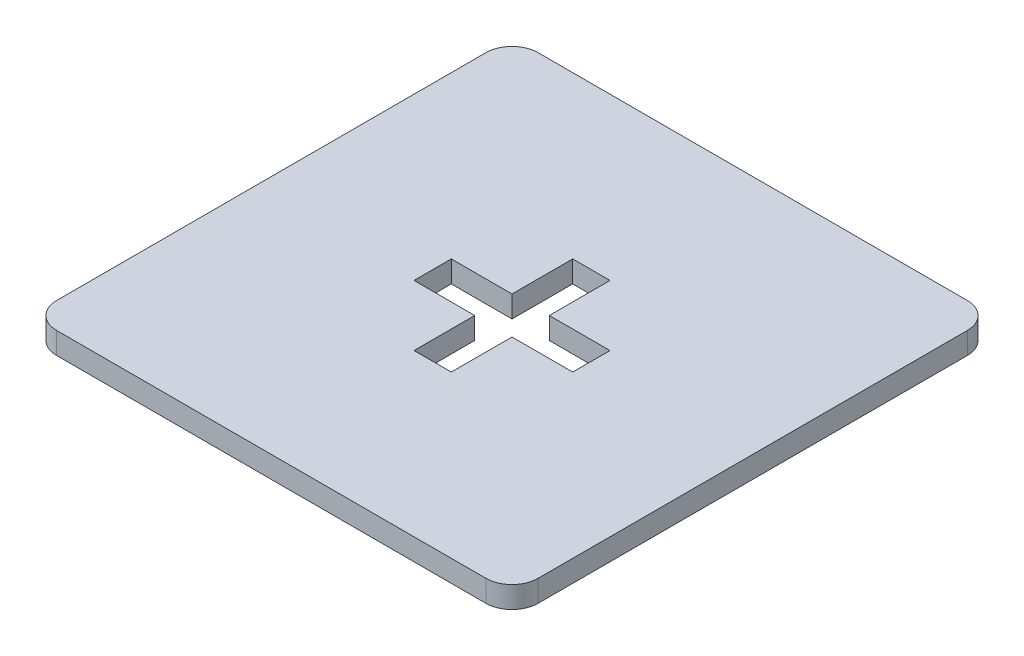
from build123d import *

# Parameters (mm, degrees)
ESBO_O1_W                = 55.5
ESBO_O1_H                = 55.5
RESSALTO_EXTRUS_O1_DEPTH = 2.5
FILETE1_R                = 3
FILETE2_R                = 3
FILETE3_R                = 3
FILETE4_R                = 3
ESBO_O3_W                = 4.3
ESBO_O3_H                = 7
ESBO_O3_W_2              = 7
ESBO_O3_H_2              = 4.3
CORTE_EXTRUS_O1_DEPTH    = 40.323974875


with BuildPart() as part:
    # Esboço1 → Ressalto-extrusão1 (new body)
    with BuildSketch(Plane(origin=(0, 0, 0), x_dir=(1, 0, 0), z_dir=(0, 1, 0))):
        Rectangle(ESBO_O1_W, ESBO_O1_H)
    extrude(amount=RESSALTO_EXTRUS_O1_DEPTH)

    # Filete1
    filete1_edges = [part.edges().sort_by_distance(p)[0] for p in [
        (27.75, 1.25, -27.75),
    ]]
    fillet(filete1_edges, radius=FILETE1_R)

    # Filete2
    filete2_edges = [part.edges().sort_by_distance(p)[0] for p in [
        (-27.75, 1.25, -27.75),
    ]]
    fillet(filete2_edges, radius=FILETE2_R)

    # Filete3
    filete3_edges = [part.edges().sort_by_distance(p)[0] for p in [
        (-27.75, 1.25, 27.75),
    ]]
    fillet(filete3_edges, radius=FILETE3_R)

    # Filete4
    filete4_edges = [part.edges().sort_by_distance(p)[0] for p in [
        (27.75, 1.25, 27.75),
    ]]
    fillet(filete4_edges, radius=FILETE4_R)

    # Esboço3 → Corte-extrusão1 (cut, through all)
    with BuildSketch(Plane(origin=(0, 2.5, 0), x_dir=(1, 0, 0), z_dir=(0, 1, 0))):
        with Locations((0, 5.65)):
            Rectangle(ESBO_O3_W, ESBO_O3_H)
        with Locations((-5.65, 0)):
            Rectangle(ESBO_O3_W_2, ESBO_O3_H_2)
        with Locations((0, -5.65)):
            Rectangle(ESBO_O3_W, ESBO_O3_H)
        Rectangle(ESBO_O3_W, ESBO_O3_H_2)
        with Locations((5.65, 0)):
            Rectangle(ESBO_O3_W_2, ESBO_O3_H_2)
    extrude(amount=-CORTE_EXTRUS_O1_DEPTH, mode=Mode.SUBTRACT)


solid = part.part
